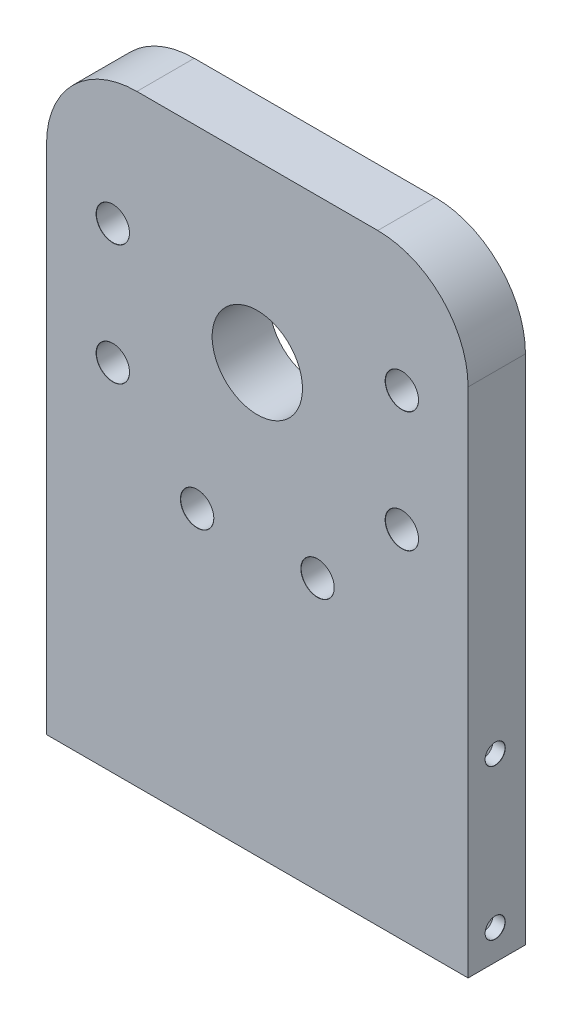
from build123d import *

# Parameters (mm, degrees)
SKETCH1_W                             = 70
SKETCH1_H                             = 100
BOSS_EXTRUDE1_DEPTH                   = 9.525
TAP_DRILL_FOR_M4X0_7_TAP1_D           = 3.3
TAP_DRILL_FOR_M4X0_7_TAP1_DEPTH       = 2
TAP_DRILL_FOR_M4X0_7_TAP1_CSINK_D     = 3.35
TAP_DRILL_FOR_M4X0_7_TAP1_CSINK_ANGLE = 90
TAP_DRILL_FOR_M4X0_7_TAP1_TIP         = 0.991420021
SKETCH6_R                             = 7.5
CUT_EXTRUDE1_DEPTH                    = 62.771560001
M5_CLEARANCE_HOLE1_D                  = 5.5
M5_CLEARANCE_HOLE1_CSINK_D            = 5.55
M5_CLEARANCE_HOLE1_CSINK_ANGLE        = 90
TAP_DRILL_FOR_M4X0_7_TAP2_AT_2_COUNT  = 2
TAP_DRILL_FOR_M4X0_7_TAP2_AT_2_PITCH  = 25
FILLET1_R                             = 15


with BuildPart() as part:
    # Sketch1 → Boss-Extrude1 (new body)
    with BuildSketch(Plane.XY):
        Rectangle(SKETCH1_W, SKETCH1_H)
    extrude(amount=BOSS_EXTRUDE1_DEPTH)

    # Tap Drill for M4x0.7 Tap1
    with Locations(Plane(origin=(0, -50, 0), x_dir=(-1, 0, 0), z_dir=(0, -1, 0))):
        with Locations((20, -4.7625), (-20, -4.7625)):
            CounterSinkHole(TAP_DRILL_FOR_M4X0_7_TAP1_D / 2, TAP_DRILL_FOR_M4X0_7_TAP1_CSINK_D / 2, depth=TAP_DRILL_FOR_M4X0_7_TAP1_DEPTH, counter_sink_angle=TAP_DRILL_FOR_M4X0_7_TAP1_CSINK_ANGLE)
            with Locations((0, 0, -(TAP_DRILL_FOR_M4X0_7_TAP1_DEPTH + TAP_DRILL_FOR_M4X0_7_TAP1_TIP / 2))):  # 118° drill point
                Cone(0, TAP_DRILL_FOR_M4X0_7_TAP1_D / 2, TAP_DRILL_FOR_M4X0_7_TAP1_TIP, mode=Mode.SUBTRACT)

    # Sketch6 → Cut-Extrude1 (cut, through all)
    with BuildSketch(Plane.XY.offset(9.525)):
        with Locations((0, 21)):
            Circle(SKETCH6_R)
    extrude(amount=-CUT_EXTRUDE1_DEPTH, mode=Mode.SUBTRACT)

    # M5 Clearance Hole1 (through all)
    with Locations(Plane.XY.offset(9.525)):
        with Locations((-10, -5), (10, -5), (24, 9), (24, 29), (-24, 9), (-24, 29)):
            CounterSinkHole(M5_CLEARANCE_HOLE1_D / 2, M5_CLEARANCE_HOLE1_CSINK_D / 2, counter_sink_angle=M5_CLEARANCE_HOLE1_CSINK_ANGLE)

    # Sketch16 → Tap Drill for M4x0.7 Tap2 (revolve, cut)
    with BuildSketch(Plane(origin=(35, -45, 5.025), x_dir=(0, 0, -1), z_dir=(0, 1, 0))):
        Polygon((0, 0), (0, 2.991420021), (1.65, 2), (1.65, 0.025), (1.675, 0), align=None)
    tap_drill_for_m4x0_7_tap2 = revolve(axis=Axis((41.35, -45, 5.025), (-1, 0, 0)), mode=Mode.SUBTRACT)

    # Tap Drill for M4x0.7 Tap2 at 2: Tap Drill for M4x0.7 Tap2 ×2
    with Locations(*[(0, i * TAP_DRILL_FOR_M4X0_7_TAP2_AT_2_PITCH, 0) for i in range(1, TAP_DRILL_FOR_M4X0_7_TAP2_AT_2_COUNT)]):
        add(tap_drill_for_m4x0_7_tap2, mode=Mode.SUBTRACT)

    # Mirror1: Tap Drill for M4x0.7 Tap2 across plane
    add(tap_drill_for_m4x0_7_tap2.mirror(Plane(origin=(0, 0, 0), x_dir=(0, 0, 1), z_dir=(1, 0, 0))), mode=Mode.SUBTRACT)

    # Mirror1 copy 1 sketch → Mirror1 copy 1 (revolve, cut)
    with BuildSketch(Plane(origin=(-35, -20, 5.025), x_dir=(0, 0, -1), z_dir=(0, 1, 0))):
        Polygon((0, 0), (0, -2.991420021), (1.65, -2), (1.65, -0.025), (1.675, 0), align=None)
    revolve(axis=Axis((-41.35, -20, 5.025), (-1, 0, 0)), mode=Mode.SUBTRACT)

    # Fillet1
    fillet1_edges = [part.edges().sort_by_distance(p)[0] for p in [
        (-35, 50, 4.7625),
        (35, 50, 4.7625),
    ]]
    fillet(fillet1_edges, radius=FILLET1_R)


solid = part.part
